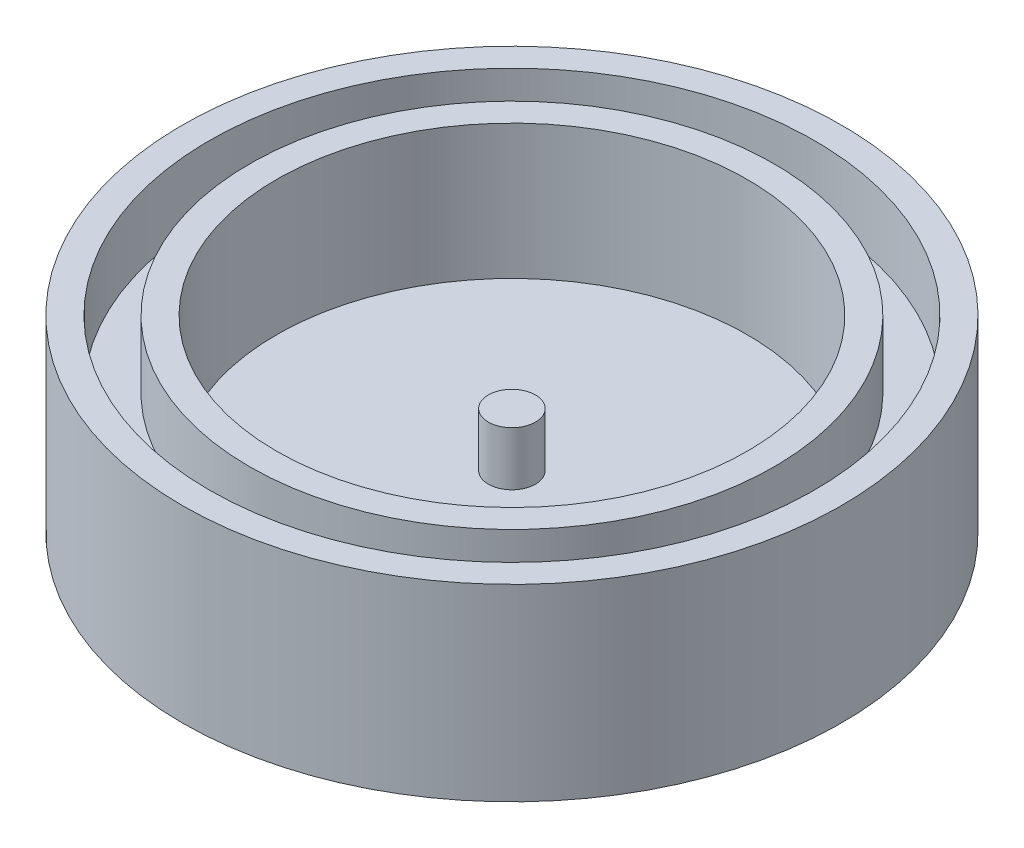
from build123d import *


with BuildPart() as part:
    # Sketch1 → Revolve1 (revolve)
    with BuildSketch(Plane.XY, mode=Mode.PRIVATE) as revolve1_sk:
        Polygon((0, 0), (-24.5, 0), (-24.5, 14), (-22.5, 14), (-22.5, 9), (-19.5, 9), (-19.5, 14), (-17.5, 14), (-17.5, 4), (-1.75, 4), (-1.75, 8), (0, 8), align=None)
    revolve(revolve1_sk.sketch.rotate(Axis((0, 8, 0), (0, -1, 0)), 270), axis=Axis((0, 8, 0), (0, -1, 0)))


solid = part.part
